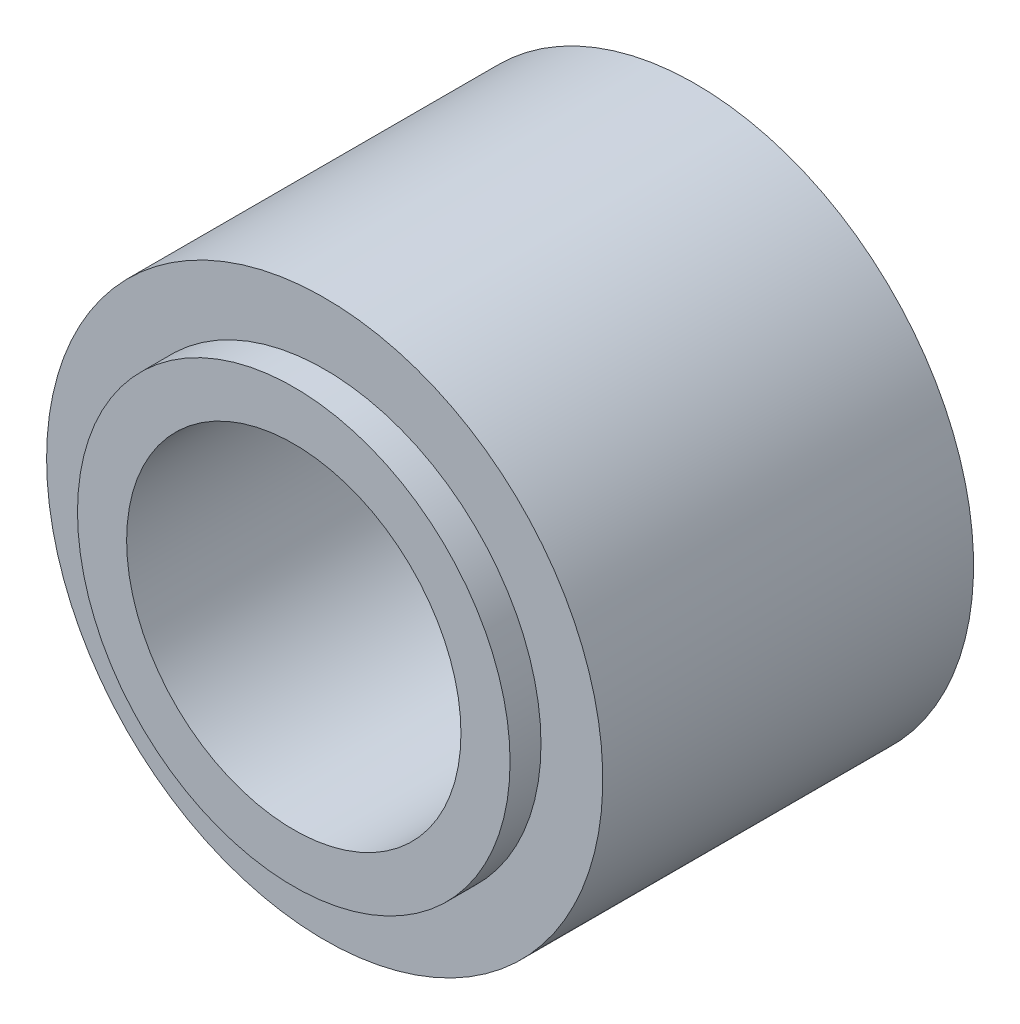
from build123d import *

# Parameters (mm, degrees)
F_1_4_32_TAPPED_HOLE1_D     = 5.4102
F_1_4_32_TAPPED_HOLE1_DEPTH = 17.2339
F_1_4_32_TAPPED_HOLE1_TIP   = 1.625388061


with BuildPart() as part:
    # Sketch1 → Revolve1 (revolve)
    with BuildSketch(Plane(origin=(0, 0, 0), x_dir=(0, 0, -1), z_dir=(1, 0, 0)), mode=Mode.PRIVATE) as revolve1_sk:
        Polygon((0, 0), (0, 4.5), (-6, 4.5), (-6, 3.5), (-6.5, 3.5), (-6.5, 0), align=None)
    revolve(revolve1_sk.sketch.rotate(Axis((0, 0, 0), (0, 0, 1)), 90), axis=Axis((0, 0, 0), (0, 0, 1)))

    # 1/4-32 Tapped Hole1
    with Locations(Plane(origin=(0, 0, 0), x_dir=(-1, 0, 0), z_dir=(0, 0, -1))):
        with Locations((0, 0)):
            Hole(F_1_4_32_TAPPED_HOLE1_D / 2, depth=F_1_4_32_TAPPED_HOLE1_DEPTH)
            with Locations((0, 0, -(F_1_4_32_TAPPED_HOLE1_DEPTH + F_1_4_32_TAPPED_HOLE1_TIP / 2))):  # 118° drill point
                Cone(0, F_1_4_32_TAPPED_HOLE1_D / 2, F_1_4_32_TAPPED_HOLE1_TIP, mode=Mode.SUBTRACT)


solid = part.part
